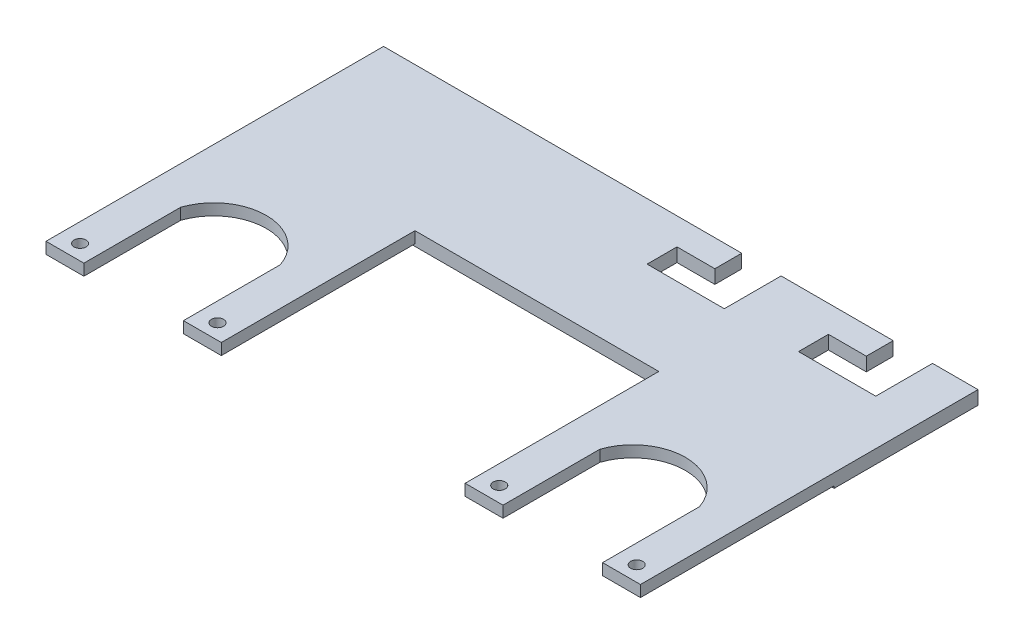
from build123d import *

# Parameters (mm, degrees)
SKETCH_1_W          = 38
SKETCH_1_H          = 3.6
EXTRUDE_1_DEPTH     = 157
SKETCH_2_R          = 1.6
EXTRUDE_2_DEPTH     = 3
CUT_EXTRUDE_1_DEPTH = 172.997042126


with BuildPart() as part:
    # 草图1 → 凸台-拉伸1 (new body)
    with BuildSketch(Plane(origin=(0, 0, 0), x_dir=(0, 0, -1), z_dir=(1, 0, 0))):
        Rectangle(SKETCH_1_W, SKETCH_1_H)
    extrude(amount=EXTRUDE_1_DEPTH)

    # 草图2 → 凸台-拉伸2 (add)
    # profile 1 of 2: a face of its own
    with BuildSketch(Plane(origin=(0, 1.8, 0), x_dir=(1, 0, 0), z_dir=(0, 1, 0))):
        with BuildLine():
            Line((36.3, -19), (10, -19))
            Line((10, -19), (0, -19))
            Line((0, -19), (0, -70.15))
            Line((0, -70.15), (10, -70.15))
            Line((10, -70.15), (10, -49))
            Line((10, -49), (10, -44.575))
            ThreePointArc((10, -44.575), (23.15, -35.125450458), (36.3, -44.575))
            Line((36.3, -44.575), (36.3, -49))
            Line((36.3, -49), (36.3, -70.15))
            Line((36.3, -70.15), (46.3, -70.15))
            Line((46.3, -70.15), (46.3, -19))
            Line((46.3, -19), (36.3, -19))
        make_face()
        with Locations(Location((5, -66.15, 0), (0, 0, 270))):
            Circle(SKETCH_2_R, mode=Mode.SUBTRACT)
        with Locations(Location((41.3, -66.15, 0), (0, 0, 270))):
            Circle(SKETCH_2_R, mode=Mode.SUBTRACT)
    # profile 2 of 2: a face of its own
    with BuildSketch(Plane(origin=(0, 1.8, 0), x_dir=(1, 0, 0), z_dir=(0, 1, 0))):
        with BuildLine():
            Line((120.7, -49), (120.7, -44.575))
            ThreePointArc((120.7, -44.575), (133.85, -35.125450458), (147, -44.575))
            Line((147, -44.575), (147, -49))
            Line((147, -49), (147, -70.15))
            Line((147, -70.15), (157, -70.15))
            Line((157, -70.15), (157, -19))
            Line((157, -19), (147, -19))
            Line((147, -19), (120.7, -19))
            Line((120.7, -19), (110.7, -19))
            Line((110.7, -19), (110.7, -70.15))
            Line((110.7, -70.15), (120.7, -70.15))
            Line((120.7, -70.15), (120.7, -49))
        make_face()
        with Locations(Location((115.7, -66.15, 0), (0, 0, 270))):
            Circle(SKETCH_2_R, mode=Mode.SUBTRACT)
        with Locations(Location((152, -66.15, 0), (0, 0, 270))):
            Circle(SKETCH_2_R, mode=Mode.SUBTRACT)
    extrude(amount=-EXTRUDE_2_DEPTH)

    # 草图4 → 切除-拉伸1 (cut, through all)
    with BuildSketch(Plane(origin=(0, 1.8, 0), x_dir=(1, 0, 0), z_dir=(0, 1, 0))):
        Polygon((105, 19.2), (94.6, 19.2), (94.6, 11.9), (84.6, 11.9), (84.6, 4), (105, 4), align=None)
        Polygon((145, 19.2), (134.6, 19.2), (134.6, 11.9), (124.6, 11.9), (124.6, 4), (145, 4), align=None)
    extrude(amount=-CUT_EXTRUDE_1_DEPTH, mode=Mode.SUBTRACT)


solid = part.part
